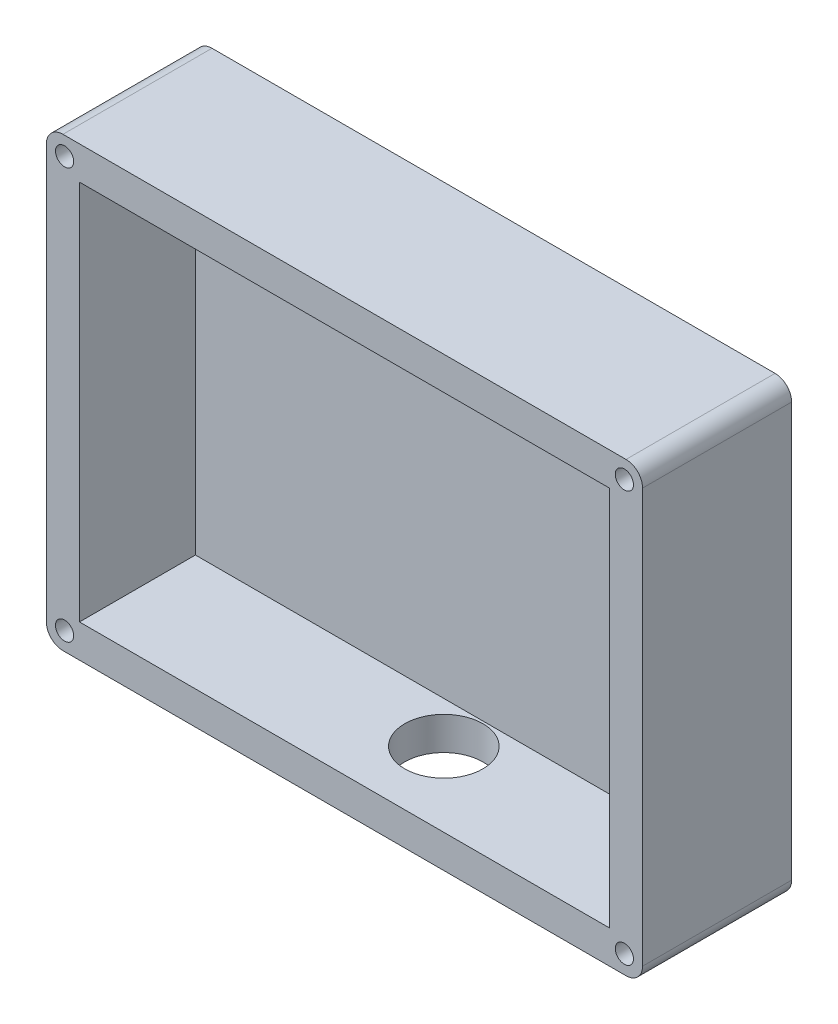
from build123d import *

# Parameters (mm, degrees)
SKETCH1_W           = 91.44
SKETCH1_H           = 68.58
BOSS_EXTRUDE1_DEPTH = 22.86
SHELL1_T            = -5.08
SKETCH2_R           = 1.397
CUT_EXTRUDE1_DEPTH  = 8.0645
FILLET1_R           = 2.54
SKETCH3_R           = 6
CUT_EXTRUDE2_DEPTH  = 5.08
SKETCH4_W           = 50.8
SKETCH4_H           = 15.875
BOSS_EXTRUDE2_DEPTH = 20.32
SKETCH5_R           = 12.9921
CUT_EXTRUDE3_DEPTH  = 104.281242035
SKETCH6_R           = 1.27
CUT_EXTRUDE4_DEPTH  = 12.6238
FILLET2_R           = 2.54


with BuildPart() as part:
    # Sketch1 → Boss-Extrude1 (new body)
    with BuildSketch(Plane.XY):
        with Locations((45.72, -34.29)):
            Rectangle(SKETCH1_W, SKETCH1_H)
    extrude(amount=BOSS_EXTRUDE1_DEPTH)

    # Shell1
    shell1_openings = [part.faces().sort_by_distance(p)[0] for p in [
        (45.72, -34.29, 22.86),
    ]]
    offset(amount=SHELL1_T, openings=shell1_openings, kind=Kind.INTERSECTION)

    # Sketch2 → Cut-Extrude1 (cut)
    with BuildSketch(Plane.XY.offset(22.86)):
        with Locations((2.794, -2.794)):
            Circle(SKETCH2_R)
        with Locations((88.646, -2.794)):
            Circle(SKETCH2_R)
        with Locations((88.646, -65.786)):
            Circle(SKETCH2_R)
        with Locations((2.794, -65.786)):
            Circle(SKETCH2_R)
    extrude(amount=-CUT_EXTRUDE1_DEPTH, mode=Mode.SUBTRACT)

    # Fillet1
    fillet1_edges = [part.edges().sort_by_distance(p)[0] for p in [
        (0, 0, 11.43),
        (91.44, 0, 11.43),
        (91.44, -68.58, 11.43),
        (0, -68.58, 11.43),
    ]]
    fillet(fillet1_edges, radius=FILLET1_R)

    # Sketch3 → Cut-Extrude2 (cut)
    with BuildSketch(Plane(origin=(0, -68.58, 0), x_dir=(-1, 0, 0), z_dir=(0, -1, 0))):
        with Locations(Location((-49.53, -11.43, 0), (0, 0, 90))):
            Circle(SKETCH3_R)
    extrude(amount=-CUT_EXTRUDE2_DEPTH, mode=Mode.SUBTRACT)

    # Sketch4 → Boss-Extrude2 (add)
    with BuildSketch(Plane(origin=(0, 0, 0), x_dir=(-1, 0, 0), z_dir=(0, 0, -1))):
        with Locations((-45.72, -34.29)):
            Rectangle(SKETCH4_W, SKETCH4_H)
    extrude(amount=BOSS_EXTRUDE2_DEPTH)

    # Sketch5 → Cut-Extrude3 (cut, through all)
    with BuildSketch(Plane.XZ.offset(42.2275)):
        with Locations((45.72, -20.32)):
            Circle(SKETCH5_R)
    extrude(amount=-CUT_EXTRUDE3_DEPTH, mode=Mode.SUBTRACT)

    # Sketch6 → Cut-Extrude4 (cut)
    with BuildSketch(Plane(origin=(0, 0, -20.32), x_dir=(-1, 0, 0), z_dir=(0, 0, -1))):
        with Locations((-26.5176, -34.29)):
            Circle(SKETCH6_R)
        with Locations((-64.9097, -34.29)):
            Circle(SKETCH6_R)
    extrude(amount=-CUT_EXTRUDE4_DEPTH, mode=Mode.SUBTRACT)

    # Fillet2
    fillet2_edges = [part.edges().sort_by_distance(p)[0] for p in [
        (20.32, -34.29, 0),
        (45.72, -26.3525, 0),
        (71.12, -34.29, 0),
        (45.72, -42.2275, 0),
    ]]
    fillet(fillet2_edges, radius=FILLET2_R)


solid = part.part
